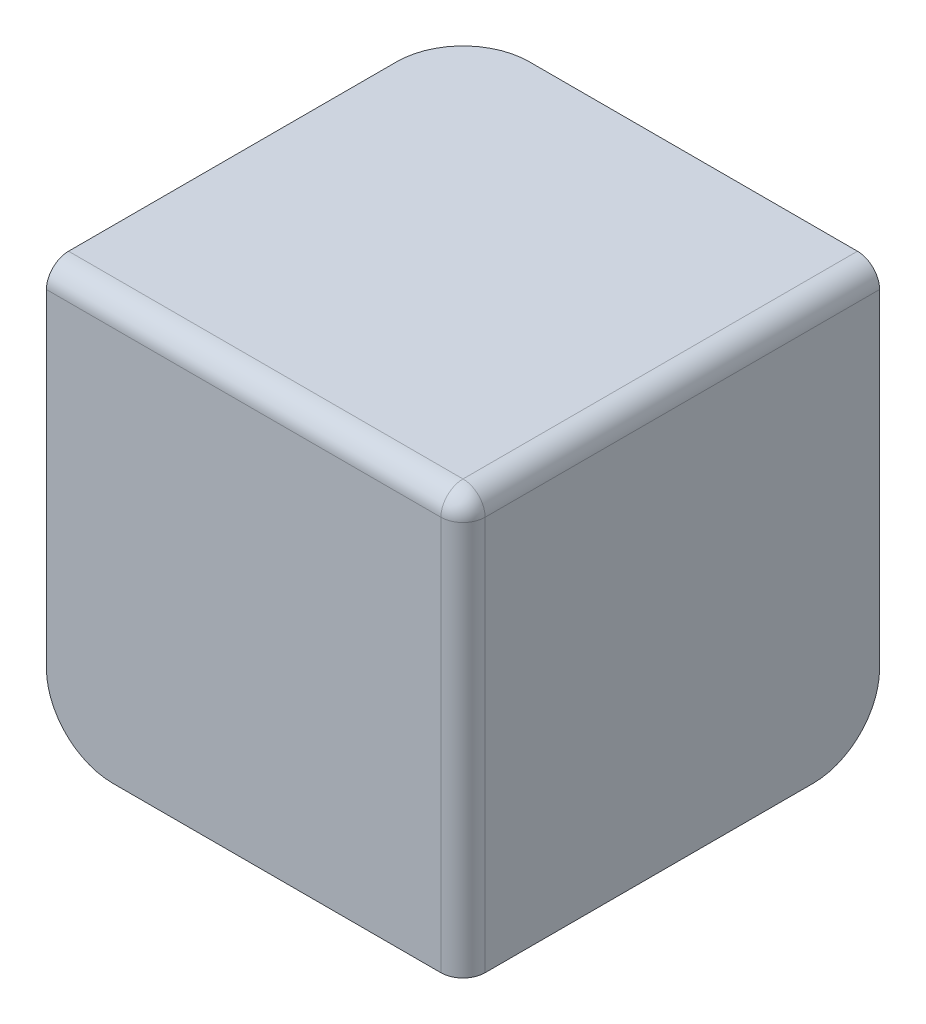
from build123d import *

# Parameters (mm, degrees)
SKETCH_1_W      = 18.84
SKETCH_1_H      = 18.84
EXTRUDE_1_DEPTH = 18.84
FILLET_1_R      = 1
FILLET_2_R      = 3


with BuildPart() as part:
    # 草图1 → 凸台-拉伸1 (new body)
    with BuildSketch(Plane(origin=(0, 0, 0), x_dir=(1, 0, 0), z_dir=(0, 1, 0))):
        Rectangle(SKETCH_1_W, SKETCH_1_H)
    extrude(amount=EXTRUDE_1_DEPTH)

    # 圆角1
    fillet_1_edges = [part.edges().sort_by_distance(p)[0] for p in [
        (0, 18.84, 9.42),
        (9.42, 18.84, 0),
        (9.42, 9.42, 9.42),
    ]]
    fillet(fillet_1_edges, radius=FILLET_1_R)

    # 圆角2
    fillet_2_edges = [part.edges().sort_by_distance(p)[0] for p in [
        (-9.42, 0, 0),
        (0, 0, -9.42),
        (-9.42, 9.42, -9.42),
    ]]
    fillet(fillet_2_edges, radius=FILLET_2_R)


solid = part.part
